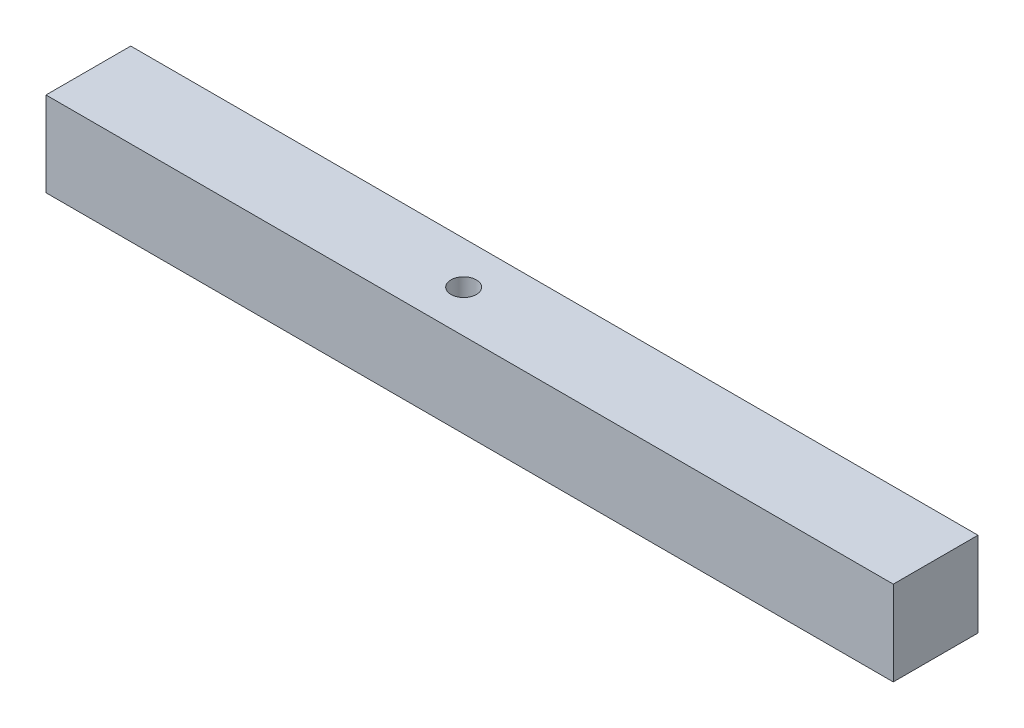
from build123d import *

# Parameters (mm, degrees)
SKIZZE1_W                       = 20
SKIZZE1_H                       = 20
AUFSATZ_LINEAR_AUSTRAGEN1_DEPTH = 200
SKIZZE2_R                       = 3
SCHNITT_LINEAR_AUSTRAGEN1_DEPTH = 202.246117975


with BuildPart() as part:
    # Skizze1 → Aufsatz-Linear austragen1 (new body)
    with BuildSketch(Plane(origin=(0, 0, 0), x_dir=(0, 0, -1), z_dir=(1, 0, 0))):
        Rectangle(SKIZZE1_W, SKIZZE1_H)
    extrude(amount=AUFSATZ_LINEAR_AUSTRAGEN1_DEPTH)

    # Skizze2 → Schnitt-Linear austragen1 (cut, through all)
    with BuildSketch(Plane(origin=(0, 10, 0), x_dir=(1, 0, 0), z_dir=(0, 1, 0))):
        with Locations(Location((88.59, 0, 0), (0, 0, 270))):
            Circle(SKIZZE2_R)
    extrude(amount=-SCHNITT_LINEAR_AUSTRAGEN1_DEPTH, mode=Mode.SUBTRACT)


solid = part.part
